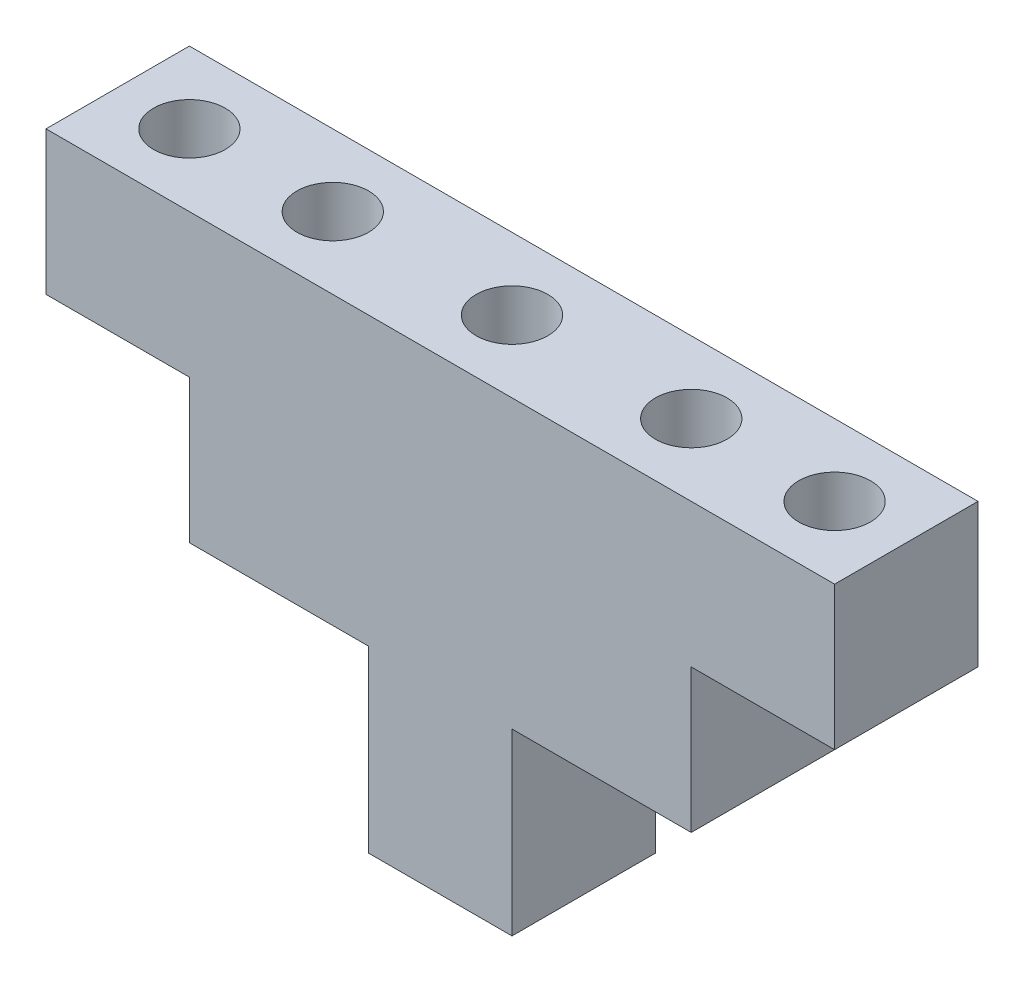
from build123d import *

# Parameters (mm, degrees)
SKETCH1_W           = 44.45
SKETCH1_H           = 12.7
SKETCH1_W_2         = 12.7
BOSS_EXTRUDE1_DEPTH = 12.7
SKETCH2_R           = 3.175
CUT_EXTRUDE1_DEPTH  = 25.4
SKETCH3_R           = 3.175
CUT_EXTRUDE2_DEPTH  = 25.4
SKETCH4_W           = 12.7
SKETCH4_H           = 12.7
BOSS_EXTRUDE2_DEPTH = 15.875
BOSS_EXTRUDE3_START = 12.7
SKETCH5_W           = 44.45
SKETCH5_H           = 12.7
SKETCH5_R           = 3.175
BOSS_EXTRUDE3_DEPTH = 12.7
SKETCH6_W           = 44.45
SKETCH6_H           = 12.7
CUT_EXTRUDE3_DEPTH  = 12.7
CUT_EXTRUDE4_REACH  = 57.54
SKETCH7_R           = 3.175


with BuildPart() as part:
    # Sketch1 → Boss-Extrude1 (new body)
    with BuildSketch(Plane.XY):
        with Locations((0, -6.35)):
            Rectangle(SKETCH1_W, SKETCH1_H)
        with Locations((0, 6.35)):
            Rectangle(SKETCH1_W, SKETCH1_H)
        with Locations((-28.575, 6.35)):
            Rectangle(SKETCH1_W_2, SKETCH1_H)
        with Locations((28.575, 6.35)):
            Rectangle(SKETCH1_W_2, SKETCH1_H)
    extrude(amount=BOSS_EXTRUDE1_DEPTH)

    # Sketch2 → Cut-Extrude1 (cut)
    with BuildSketch(Plane.XZ.offset(12.7)):
        with Locations(Location((-15.875, 6.35, 0), (0, 0, 270))):
            Circle(SKETCH2_R)
        with Locations(Location((15.875, 6.35, 0), (0, 0, 270))):
            Circle(SKETCH2_R)
    extrude(amount=-CUT_EXTRUDE1_DEPTH, mode=Mode.SUBTRACT)

    # Sketch3 → Cut-Extrude2 (cut)
    with BuildSketch(Plane.XZ):
        with Locations(Location((-28.575, 6.35, 0), (0, 0, 270))):
            Circle(SKETCH3_R)
        with Locations(Location((28.575, 6.35, 0), (0, 0, 270))):
            Circle(SKETCH3_R)
    extrude(amount=-CUT_EXTRUDE2_DEPTH, mode=Mode.SUBTRACT)

    # Sketch4 → Boss-Extrude2 (add)
    with BuildSketch(Plane.XZ.offset(12.7)):
        with Locations((0, 6.35)):
            Rectangle(SKETCH4_W, SKETCH4_H)
    extrude(amount=BOSS_EXTRUDE2_DEPTH)

    # Sketch5 → Boss-Extrude3 (add)
    with BuildSketch(Plane.XZ.offset(28.575).offset(BOSS_EXTRUDE3_START)):
        with Locations((0, 6.35)):
            Rectangle(SKETCH5_W, SKETCH5_H)
        with Locations(Location((-15.875, 6.35, 0), (0, 0, 270))):
            Circle(SKETCH5_R, mode=Mode.SUBTRACT)
        with Locations(Location((15.875, 6.35, 0), (0, 0, 270))):
            Circle(SKETCH5_R, mode=Mode.SUBTRACT)
    extrude(amount=-BOSS_EXTRUDE3_DEPTH)

    # Sketch6 → Cut-Extrude3 (cut)
    with BuildSketch(Plane.XZ.offset(41.275)):
        with Locations((0, 6.35)):
            Rectangle(SKETCH6_W, SKETCH6_H)
    extrude(amount=-CUT_EXTRUDE3_DEPTH, mode=Mode.SUBTRACT)

    # Sketch7 → Cut-Extrude4 (cut, up to next)
    with BuildSketch(Plane.XZ.offset(28.575), mode=Mode.PRIVATE) as cut_extrude4_sk1:
        with Locations(Location((0, 6.35, 0), (0, 0, 270))):
            Circle(SKETCH7_R)
    cut_extrude4_tool1 = extrude(cut_extrude4_sk1.sketch, amount=-CUT_EXTRUDE4_REACH, mode=Mode.PRIVATE) & part.part
    add(cut_extrude4_tool1.solids().sort_by_distance((0, -28.575, 6.35))[0], mode=Mode.SUBTRACT)


solid = part.part
